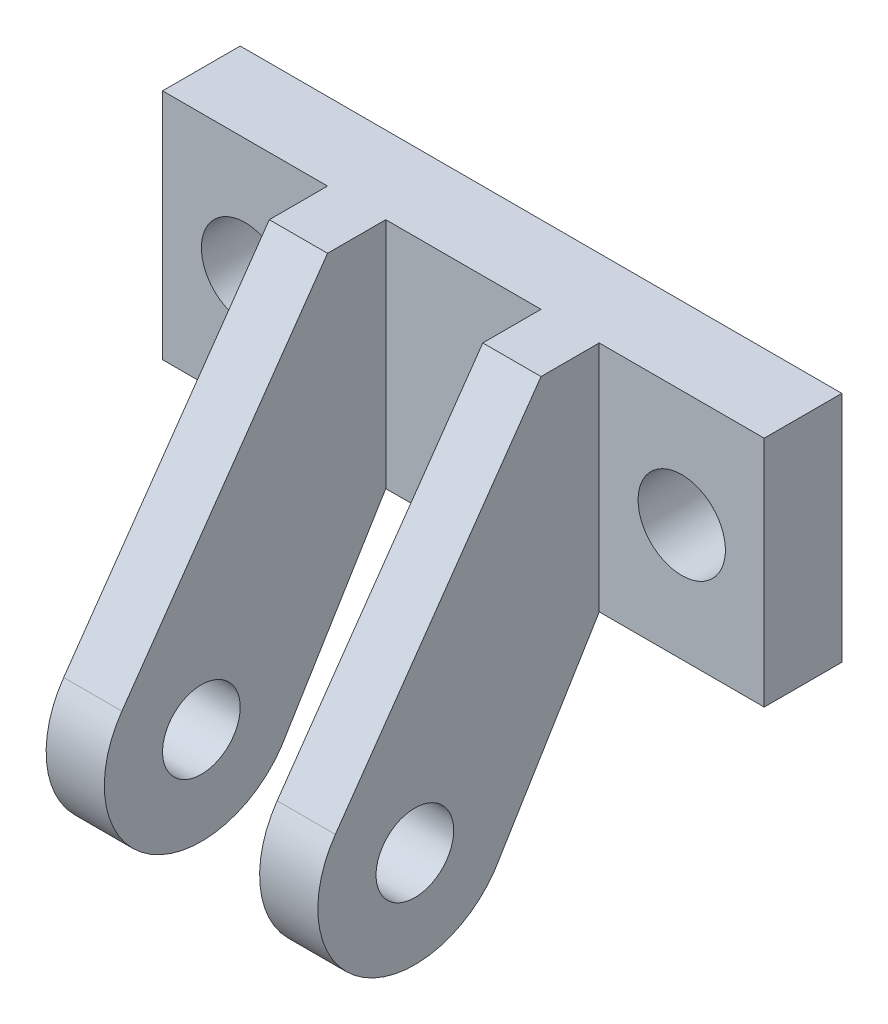
from build123d import *

# Parameters (mm, degrees)
SKETCH_1_W               = 62
SKETCH_1_H               = 24
SKETCH_1_R               = 4.5
EXTRUDE_1_DEPTH          = 8
EXTRUDE_2_DEPTH          = 14
CUT_EXTRUDE_2_DEPTH      = 8
CUT_EXTRUDE_3_DEPTH      = 68.453687816
CUT_EXTRUDE_3_DEPTH_BACK = 68.453687816
SKETCH_6_R               = 4


with BuildPart() as part:
    # 草图1 → 凸台-拉伸1 (new body)
    with BuildSketch(Plane.XY):
        Rectangle(SKETCH_1_W, SKETCH_1_H)
        with Locations((-22.5, 0)):
            Circle(SKETCH_1_R, mode=Mode.SUBTRACT)
        with Locations(Location((22.5, 0, 0), (0, 0, 180))):
            Circle(SKETCH_1_R, mode=Mode.SUBTRACT)
    extrude(amount=EXTRUDE_1_DEPTH)

    # 草图2 → 凸台-拉伸2 (add, symmetric)
    with BuildSketch(Plane(origin=(0, 0, 0), x_dir=(0, 0, -1), z_dir=(1, 0, 0))):
        with BuildLine():
            Line((-8, 12), (-14, 12))
            Line((-14, 12), (-35.191485533, -18.26418578))
            ThreePointArc((-35.191485533, -18.26418578), (-32.73581422, -32.191485533), (-18.808514467, -29.73581422))
            Line((-18.808514467, -29.73581422), (-8, -12))
            Line((-8, -12), (0, -12))
            Line((0, -12), (0, 12))
            Line((0, 12), (-8, 12))
        make_face()
    extrude(amount=EXTRUDE_2_DEPTH, both=True)

    # 草图5 → 切除-拉伸2 (cut, symmetric)
    with BuildSketch(Plane(origin=(0, 0, 0), x_dir=(0, 0, -1), z_dir=(1, 0, 0))):
        with BuildLine():
            Line((-18.808514467, -29.73581422), (-8, -12))
            Line((-8, -12), (-8, 12))
            Line((-8, 12), (-14, 12))
            Line((-14, 12), (-35.191485533, -18.26418578))
            ThreePointArc((-35.191485533, -18.26418578), (-32.73581422, -32.191485533), (-18.808514467, -29.73581422))
        make_face()
    extrude(amount=CUT_EXTRUDE_2_DEPTH, both=True, mode=Mode.SUBTRACT)

    # 草图6 → 切除-拉伸3 (cut, two sides: drawn at the far end of the back side and taken through both)
    with BuildSketch(Plane(origin=(14, 0, 0), x_dir=(0, 0, -1), z_dir=(1, 0, 0)).offset(-CUT_EXTRUDE_3_DEPTH_BACK)):
        with Locations((-27, -24)):
            Circle(SKETCH_6_R)
    extrude(amount=CUT_EXTRUDE_3_DEPTH + CUT_EXTRUDE_3_DEPTH_BACK, mode=Mode.SUBTRACT)


solid = part.part
